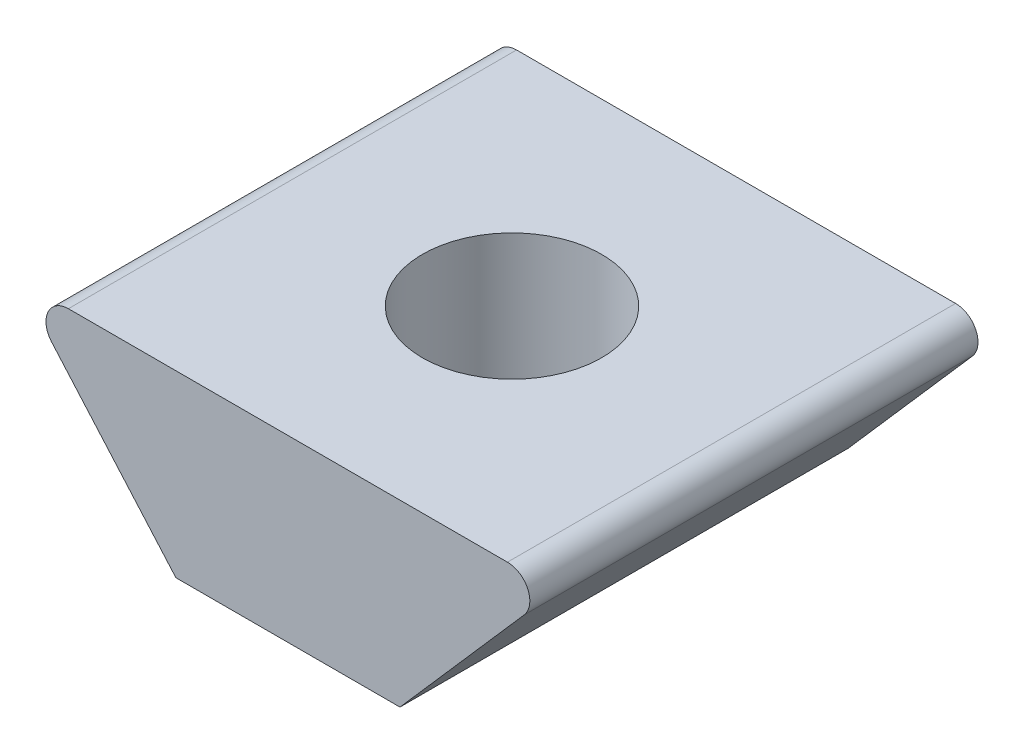
from build123d import *

# Parameters (mm, degrees)
EXTRUDE_1_DEPTH     = 10
SKETCH_3_R          = 2
CUT_EXTRUDE_1_DEPTH = 13.328828006
FILLET_2_R          = 0.5


with BuildPart() as part:
    # ｽｹｯﾁ2 → ﾎﾞｽ - 押し出し1 (new body)
    with BuildSketch(Plane.XY):
        Polygon((-6, 4), (6, 4), (2.5, 0), (-2.5, 0), align=None)
    extrude(amount=EXTRUDE_1_DEPTH)

    # ｽｹｯﾁ3 → ｶｯﾄ - 押し出し1 (cut, through all)
    with BuildSketch(Plane(origin=(0, 4, 0), x_dir=(1, 0, 0), z_dir=(0, 1, 0))):
        with Locations(Location((0, -5, 0), (0, 0, 270))):
            Circle(SKETCH_3_R)
    extrude(amount=-CUT_EXTRUDE_1_DEPTH, mode=Mode.SUBTRACT)

    # ﾌｨﾚｯﾄ2
    fillet_2_edges = [part.edges().sort_by_distance(p)[0] for p in [
        (-6, 4, 5),
        (6, 4, 5),
    ]]
    fillet(fillet_2_edges, radius=FILLET_2_R)


solid = part.part
